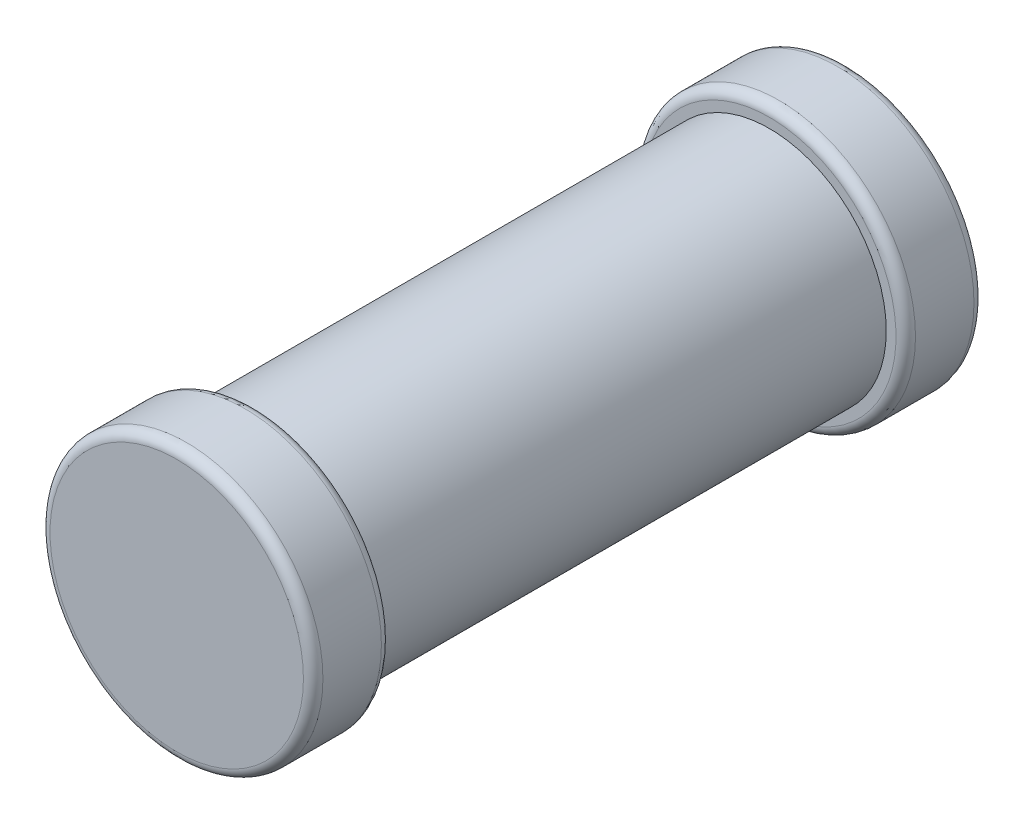
from build123d import *

# Parameters (mm, degrees)
EXTRUS_O1_DEPTH        = 1.32
EXTRUS_O1_DEPTH_BACK   = 1.32
ESBO_O1_R              = 0.6
ESBO_O2_R              = 0.7
EXTRUS_O2_DEPTH        = 0.4
FILETE1_R              = 0.05
FILETE1_OF_ESPELHAR1_R = 0.05


with BuildPart() as part:
    # Esboço1 → Extrusão1 (new, two sides: drawn at the far end of the back side and taken through both)
    with BuildSketch(Plane.XY.offset(-EXTRUS_O1_DEPTH_BACK)):
        Circle(ESBO_O1_R)
    extrude(amount=EXTRUS_O1_DEPTH + EXTRUS_O1_DEPTH_BACK)

    # Esboço2 → Extrusão2 (add)
    with BuildSketch(Plane.XY.offset(1.32)):
        Circle(ESBO_O2_R)
    extrus_o2 = extrude(amount=EXTRUS_O2_DEPTH)

    # Filete1
    filete1_edges = [part.edges().sort_by_distance(p)[0] for p in [
        (-0.7, 0, 1.72),
        (-0.7, 0, 1.32),
    ]]
    fillet(filete1_edges, radius=FILETE1_R)

    # Espelhar1: Extrusão2 across plane
    add(extrus_o2.mirror(Plane.XY))

    # Filete1 of Espelhar1
    filete1_of_espelhar1_edges = [part.edges().sort_by_distance(p)[0] for p in [
        (-0.7, 0, -1.72),
        (-0.7, 0, -1.32),
    ]]
    fillet(filete1_of_espelhar1_edges, radius=FILETE1_OF_ESPELHAR1_R)


solid = part.part
